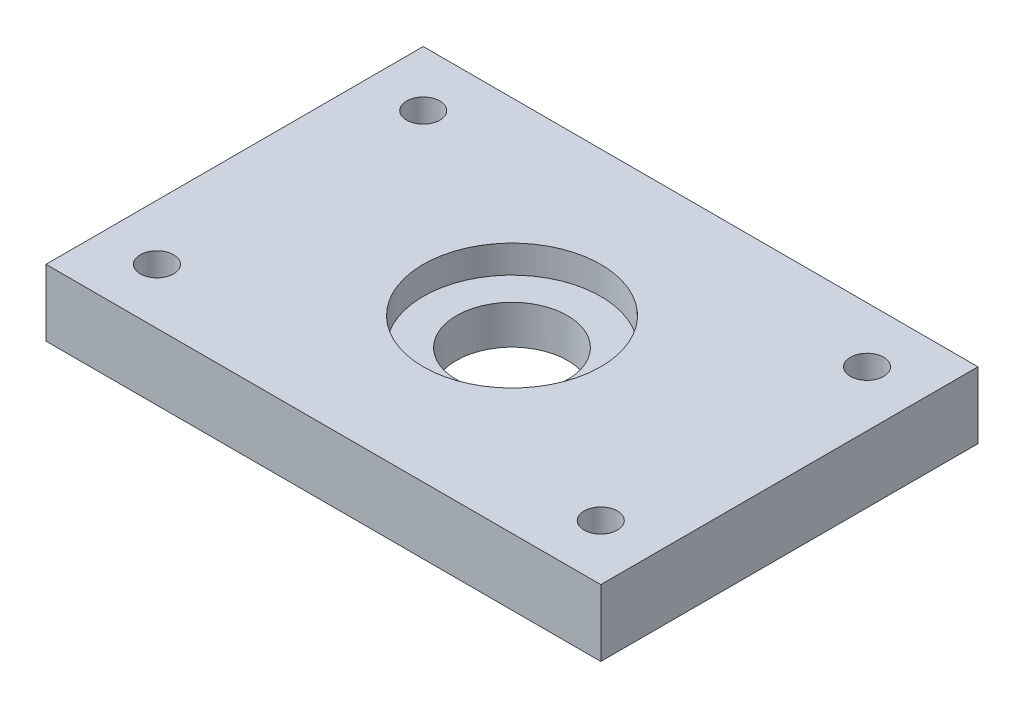
from build123d import *

# Parameters (mm, degrees)
SKETCH1_W                                = 50
SKETCH1_H                                = 34
BEARING_HOLDER_PLATE_BOSS_EXTRUDE1_DEPTH = 6
SKETCH3_R                                = 1.5
MOUNTING_HOLES_CUT_EXTRUDE1_DEPTH        = 6
SKETCH4_R                                = 5
SHAFT_CUT_EXTRUDE2_DEPTH                 = 6
SKETCH5_R                                = 8
BEARING_CUT_EXTRUDE3_DEPTH               = 2.5


with BuildPart() as part:
    # Sketch1 → Bearing Holder Plate Boss-Extrude1 (new body)
    with BuildSketch(Plane(origin=(0, 0, 0), x_dir=(1, 0, 0), z_dir=(0, 1, 0))):
        Rectangle(SKETCH1_W, SKETCH1_H)
    extrude(amount=BEARING_HOLDER_PLATE_BOSS_EXTRUDE1_DEPTH)

    # Sketch3 → Mounting Holes Cut-Extrude1 (cut)
    with BuildSketch(Plane.XZ):
        with Locations(Location((20, 12, 0), (0, 0, 270))):
            Circle(SKETCH3_R)
        with Locations(Location((-20, 12, 0), (0, 0, 270))):
            Circle(SKETCH3_R)
        with Locations(Location((-20, -12, 0), (0, 0, 270))):
            Circle(SKETCH3_R)
        with Locations(Location((20, -12, 0), (0, 0, 270))):
            Circle(SKETCH3_R)
    extrude(amount=-MOUNTING_HOLES_CUT_EXTRUDE1_DEPTH, mode=Mode.SUBTRACT)

    # Sketch4 → Shaft Cut-Extrude2 (cut)
    with BuildSketch(Plane(origin=(0, 6, 0), x_dir=(1, 0, 0), z_dir=(0, 1, 0))):
        with Locations(Location((0, 0, 0), (0, 0, 270))):
            Circle(SKETCH4_R)
    extrude(amount=-SHAFT_CUT_EXTRUDE2_DEPTH, mode=Mode.SUBTRACT)

    # Sketch5 → Bearing Cut-Extrude3 (cut)
    with BuildSketch(Plane(origin=(0, 6, 0), x_dir=(1, 0, 0), z_dir=(0, 1, 0))):
        with Locations(Location((0, 0, 0), (0, 0, 270))):
            Circle(SKETCH5_R)
    extrude(amount=-BEARING_CUT_EXTRUDE3_DEPTH, mode=Mode.SUBTRACT)


solid = part.part
